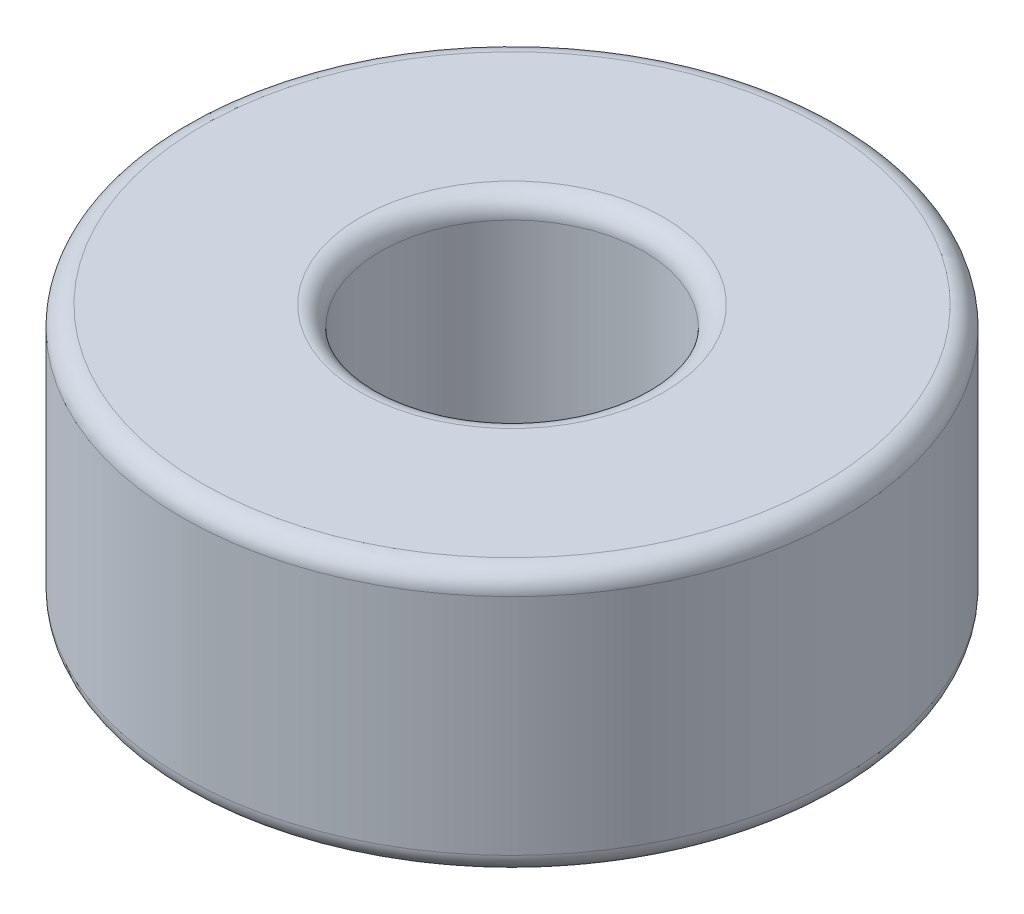
from build123d import *

# Parameters (mm, degrees)
SKETCH1_R           = 5
SKETCH1_R_2         = 2
BOSS_EXTRUDE1_DEPTH = 4
FILLET1_R           = 0.3


with BuildPart() as part:
    # Sketch1 → Boss-Extrude1 (new body)
    with BuildSketch(Plane(origin=(0, 0, 0), x_dir=(1, 0, 0), z_dir=(0, 1, 0))):
        with Locations(Location((-50.338364472, 5.679200094, 0), (0, 0, 270))):
            Circle(SKETCH1_R)
        with Locations(Location((-50.338364472, 5.679200094, 0), (0, 0, 270))):
            Circle(SKETCH1_R_2, mode=Mode.SUBTRACT)
    extrude(amount=BOSS_EXTRUDE1_DEPTH)

    # Fillet1
    fillet1_edges = [part.edges().sort_by_distance(p)[0] for p in [
        (-50.338364472, 0, -10.679200094),
        (-50.338364472, 4, -10.679200094),
        (-50.338364472, 0, -7.679200094),
        (-50.338364472, 4, -7.679200094),
    ]]
    fillet(fillet1_edges, radius=FILLET1_R)


solid = part.part
